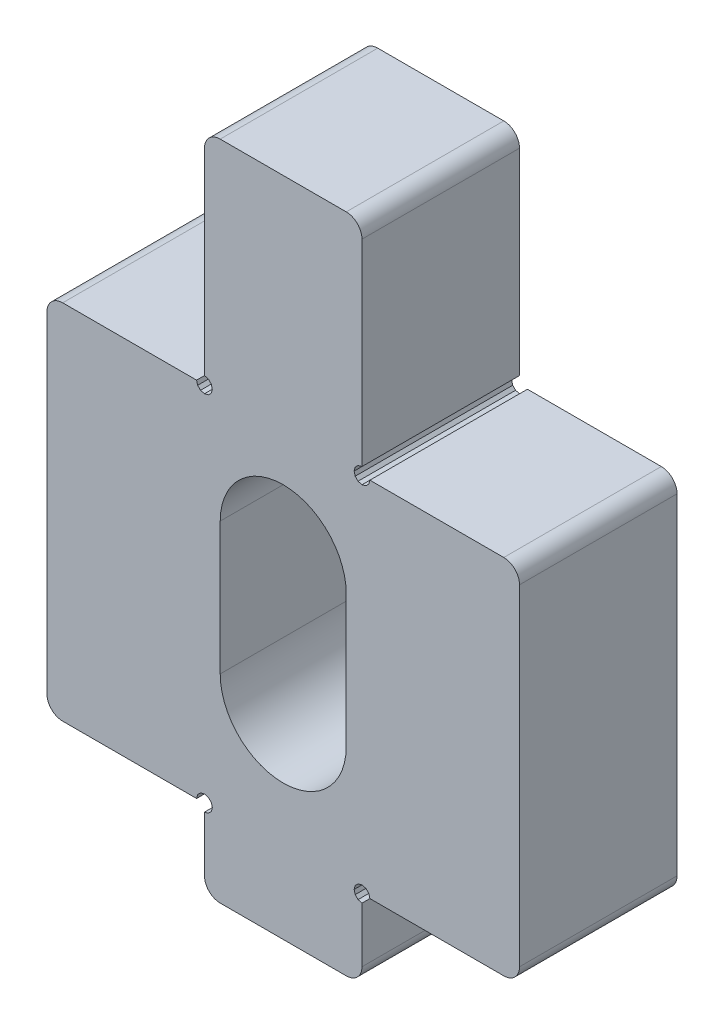
from build123d import *

# Parameters (mm, degrees)
BOSS_EXTRU_1_DEPTH = 5


with BuildPart() as part:
    # Esquisse1 → Boss.-Extru.1 (new body)
    with BuildSketch(Plane.XY.offset(5)):
        with BuildLine():
            Line((10, 14.25), (10, 20.5))
            ThreePointArc((10, 20.5), (9.853553391, 20.853553391), (9.5, 21))
            Line((9.5, 21), (5.5, 21))
            ThreePointArc((5.5, 21), (5.146446609, 20.853553391), (5, 20.5))
            Line((5, 20.5), (5, 14.25))
            Line((5, 14.25), (5.125, 14.21651))
            Line((5.125, 14.21651), (5.216506, 14.125))
            Line((5.216506, 14.125), (5.25, 14))
            Line((5.25, 14), (5.216506, 13.875))
            Line((5.216506, 13.875), (5.125, 13.78349))
            Line((5.125, 13.78349), (5, 13.75))
            Line((5, 13.75), (4.875, 13.78349))
            Line((4.875, 13.78349), (4.783494, 13.875))
            Line((4.783494, 13.875), (4.75, 14))
            Line((4.75, 14), (0.5, 14))
            ThreePointArc((0.5, 14), (0.146446609, 13.853553391), (0, 13.5))
            Line((0, 13.5), (0, 3))
            ThreePointArc((0, 3), (0.146446609, 2.646446609), (0.5, 2.5))
            Line((0.5, 2.5), (4.75, 2.5))
            Line((4.75, 2.5), (4.783494, 2.625))
            Line((4.783494, 2.625), (4.875, 2.716506))
            Line((4.875, 2.716506), (5, 2.75))
            Line((5, 2.75), (5.125, 2.716506))
            Line((5.125, 2.716506), (5.216506, 2.625))
            Line((5.216506, 2.625), (5.25, 2.5))
            Line((5.25, 2.5), (5.216506, 2.375))
            Line((5.216506, 2.375), (5.125, 2.283494))
            Line((5.125, 2.283494), (5, 2.25))
            Line((5, 2.25), (5, 0.4999999))
            ThreePointArc((5, 0.4999999), (5.14644658, 0.14644658), (5.4999999, 0))
            Line((5.4999999, 0), (9.5, 0))
            ThreePointArc((9.5, 0), (9.853553391, 0.146446609), (10, 0.5))
            Line((10, 0.5), (10, 2.25))
            Line((10, 2.25), (9.875, 2.283494))
            Line((9.875, 2.283494), (9.783493, 2.375))
            Line((9.783493, 2.375), (9.75, 2.5))
            Line((9.75, 2.5), (9.783493, 2.625))
            Line((9.783493, 2.625), (9.875, 2.716506))
            Line((9.875, 2.716506), (10, 2.75))
            Line((10, 2.75), (10.125, 2.716506))
            Line((10.125, 2.716506), (10.21651, 2.625))
            Line((10.21651, 2.625), (10.25, 2.5))
            Line((10.25, 2.5), (14.5, 2.5))
            ThreePointArc((14.5, 2.5), (14.853553391, 2.646446609), (15, 3))
            Line((15, 3), (15, 13.5))
            ThreePointArc((15, 13.5), (14.853553391, 13.853553391), (14.5, 14))
            Line((14.5, 14), (10.25, 14))
            Line((10.25, 14), (10.21651, 13.875))
            Line((10.21651, 13.875), (10.125, 13.78349))
            Line((10.125, 13.78349), (10, 13.75))
            Line((10, 13.75), (9.875, 13.78349))
            Line((9.875, 13.78349), (9.783493, 13.875))
            Line((9.783493, 13.875), (9.75, 14))
            Line((9.75, 14), (9.783493, 14.125))
            Line((9.783493, 14.125), (9.875, 14.21651))
            Line((9.875, 14.21651), (10, 14.25))
        make_face()
        with BuildLine():
            Line((5.5, 10.5), (5.5, 6.3))
            ThreePointArc((5.5, 6.3), (7.5, 4.3), (9.5, 6.3))
            Line((9.5, 6.3), (9.5, 10.5))
            ThreePointArc((9.5, 10.5), (7.5, 12.5), (5.5, 10.5))
        make_face(mode=Mode.SUBTRACT)
    extrude(amount=-BOSS_EXTRU_1_DEPTH)


solid = part.part
